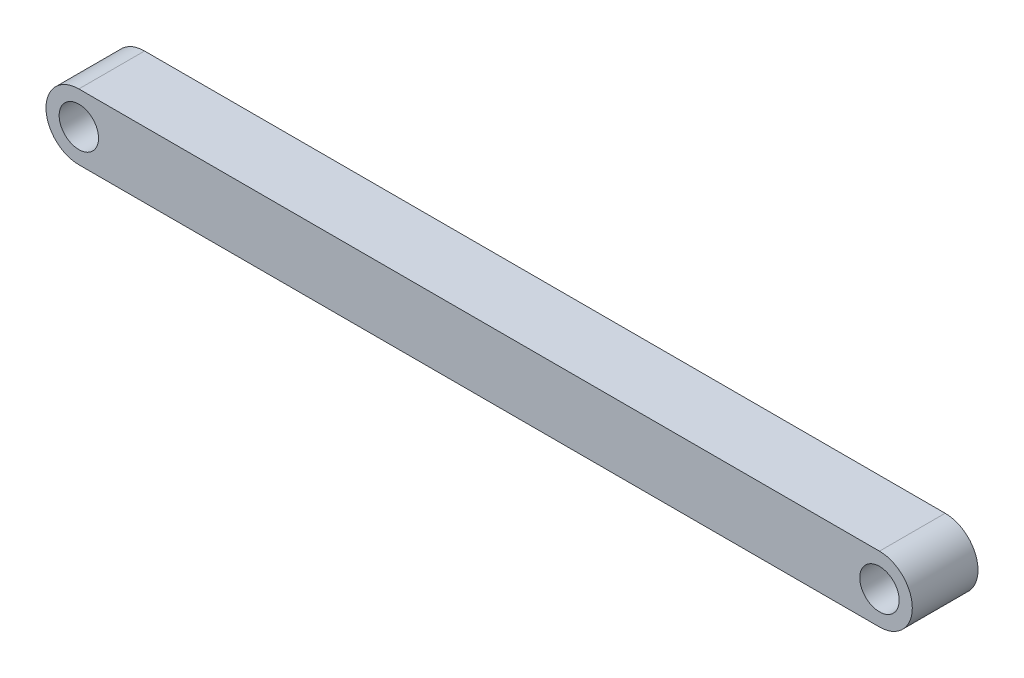
from build123d import *

# Parameters (mm, degrees)
SKETCH1_R           = 1.5
BOSS_EXTRUDE1_DEPTH = 2.5


with BuildPart() as part:
    # Sketch1 → Boss-Extrude1 (new, symmetric)
    with BuildSketch(Plane.XY):
        with BuildLine():
            Line((-30.46875, 2.5), (30.46875, 2.5))
            ThreePointArc((30.46875, 2.5), (32.96875, 0), (30.46875, -2.5))
            Line((30.46875, -2.5), (-30.46875, -2.5))
            ThreePointArc((-30.46875, -2.5), (-32.96875, 0), (-30.46875, 2.5))
        make_face()
        with Locations((-30.46875, 0)):
            Circle(SKETCH1_R, mode=Mode.SUBTRACT)
        with Locations((30.46875, 0)):
            Circle(SKETCH1_R, mode=Mode.SUBTRACT)
    extrude(amount=BOSS_EXTRUDE1_DEPTH, both=True)


solid = part.part
